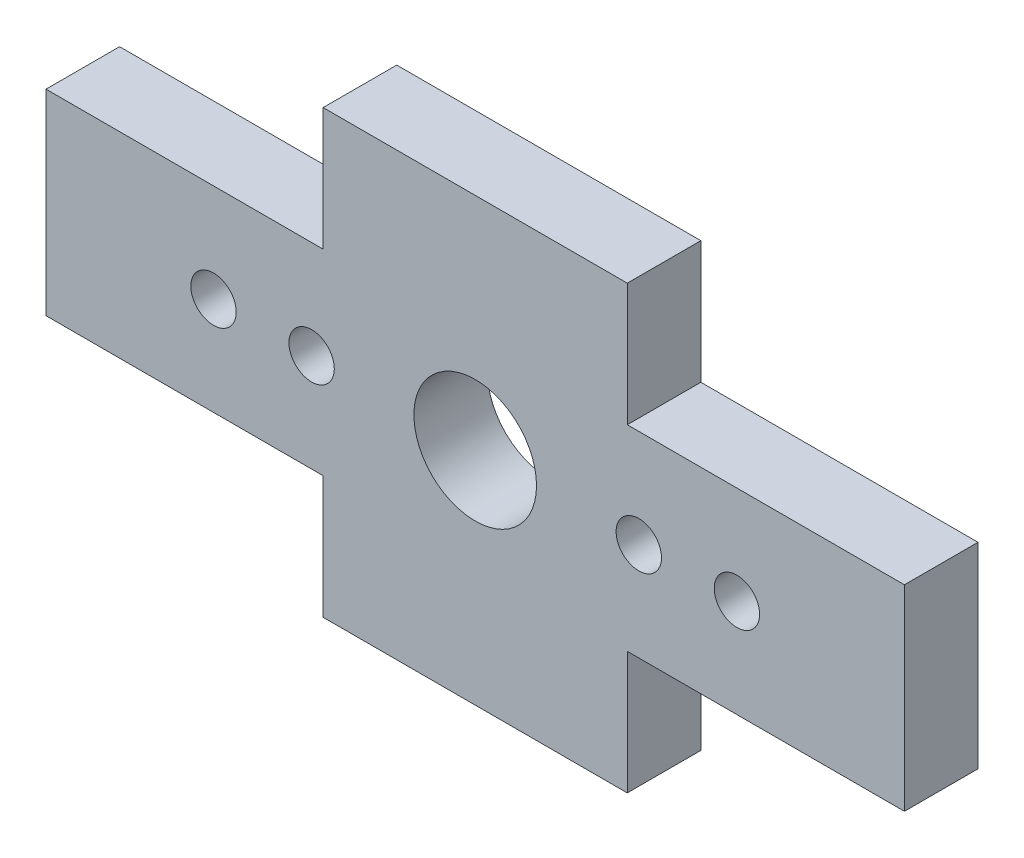
from build123d import *

# Parameters (mm, degrees)
ESQUISSE1_R        = 2.5
ESQUISSE1_R_2      = 0.925
BOSS_EXTRU_1_DEPTH = 3


with BuildPart() as part:
    # Esquisse1 → Boss.-Extru.1 (new body)
    with BuildSketch(Plane.XY):
        Polygon((-17.5, -4), (-17.5, 4), (-6.2, 4), (-6.2, 9), (6.2, 9), (6.2, 4), (17.5, 4), (17.5, -4), (6.2, -4), (6.2, -9), (-6.2, -9), (-6.2, -4), align=None)
        Circle(ESQUISSE1_R, mode=Mode.SUBTRACT)
        with Locations((6.67, 0)):
            Circle(ESQUISSE1_R_2, mode=Mode.SUBTRACT)
        with Locations((10.67, 0)):
            Circle(ESQUISSE1_R_2, mode=Mode.SUBTRACT)
        with Locations((-6.67, 0)):
            Circle(ESQUISSE1_R_2, mode=Mode.SUBTRACT)
        with Locations((-10.67, 0)):
            Circle(ESQUISSE1_R_2, mode=Mode.SUBTRACT)
    extrude(amount=BOSS_EXTRU_1_DEPTH)


solid = part.part
